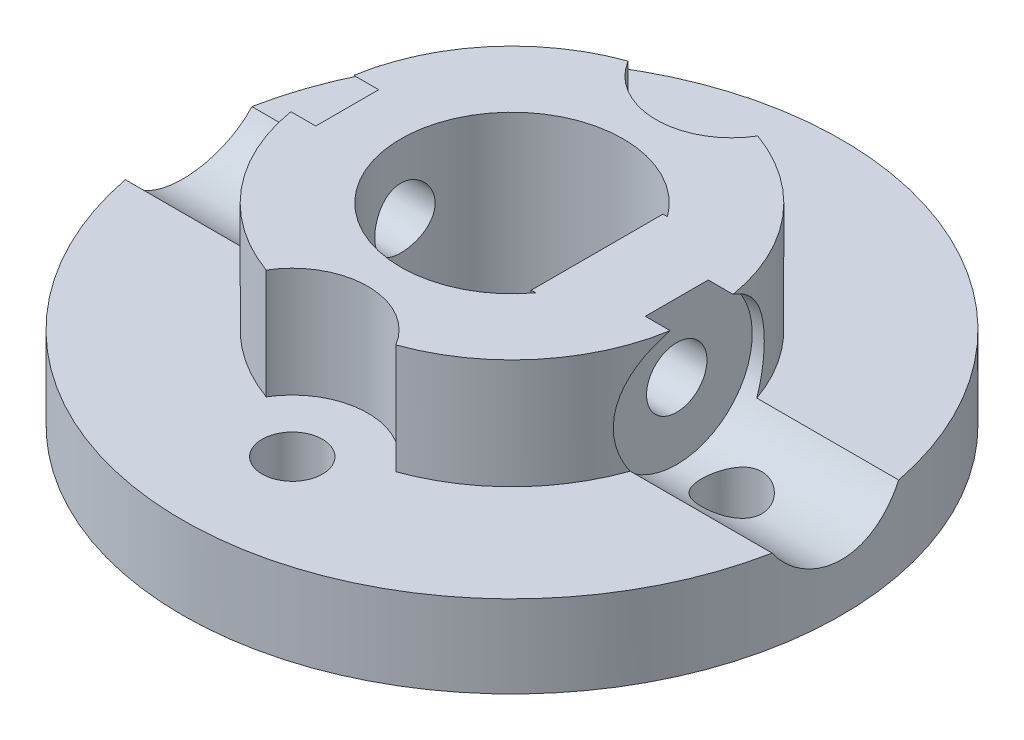
from build123d import *

# Parameters (mm, degrees)
STOCK_HORN_DRIVE_FLANGE_START              = 41
STOCK_HORN_DRIVE_FLANGE_PROFILE_R          = 12
STOCK_HORN_DRIVE_FLANGE_PROFILE_R_2        = 4.05
STOCK_HORN_DRIVE_FLANGE_DEPTH              = 3
D_COUPLING_RING_START                      = 44
D_COUPLING_RING_PROFILE_R                  = 7
D_COUPLING_RING_PROFILE_R_2                = 4.05
D_COUPLING_RING_DEPTH                      = 4
D_KEY_LAND_START                           = 44
D_KEY_LAND_PROFILE_W                       = 2.9
D_KEY_LAND_PROFILE_H                       = 4.8
D_KEY_LAND_DEPTH                           = 4
STOCK_HORN_SCREWS_START                    = 39
STOCK_HORN_SCREWS_PROFILE_R                = 1.1
STOCK_HORN_SCREWS_DEPTH                    = 12.911688245
TWO_HORN_WASHER_CLEARANCES_START           = 44
TWO_HORN_WASHER_CLEARANCES_PROFILE_R       = 2.75
TWO_HORN_WASHER_CLEARANCES_DEPTH           = 4
YAW_POSITIVE_RETENTION_CROSSBOLT_START     = -10
YAW_POSITIVE_RETENTION_CROSSBOLT_PROFILE_R = 1.1
YAW_POSITIVE_RETENTION_CROSSBOLT_DEPTH     = 61.911688245
CROSSBOLT_FLAT_SEAT_CUT_12_START           = -12
CROSSBOLT_FLAT_SEAT_12_R                   = 2.75
CROSSBOLT_FLAT_SEAT_CUT_12_DEPTH           = 6
CROSSBOLT_FLAT_SEAT_CUT_6_START            = 6
CROSSBOLT_FLAT_SEAT_6_R                    = 2.75
CROSSBOLT_FLAT_SEAT_CUT_6_DEPTH            = 6


with BuildPart() as part:
    # Stock_horn_drive_flange_profile → Stock_horn_drive_flange (new body)
    with BuildSketch(Plane(origin=(0, 0, 0), x_dir=(1, 0, 0), z_dir=(0, 1, 0)).offset(STOCK_HORN_DRIVE_FLANGE_START)):
        with Locations(Location((0, 0, 0), (0, 0, 270))):
            Circle(STOCK_HORN_DRIVE_FLANGE_PROFILE_R)
        with Locations(Location((0, 0, 0), (0, 0, 270))):
            Circle(STOCK_HORN_DRIVE_FLANGE_PROFILE_R_2, mode=Mode.SUBTRACT)
    extrude(amount=STOCK_HORN_DRIVE_FLANGE_DEPTH)

    # D_coupling_ring_profile → D_coupling_ring (add)
    with BuildSketch(Plane(origin=(0, 0, 0), x_dir=(1, 0, 0), z_dir=(0, 1, 0)).offset(D_COUPLING_RING_START)):
        with Locations(Location((0, 0, 0), (0, 0, 270))):
            Circle(D_COUPLING_RING_PROFILE_R)
        with Locations(Location((0, 0, 0), (0, 0, 270))):
            Circle(D_COUPLING_RING_PROFILE_R_2, mode=Mode.SUBTRACT)
    extrude(amount=D_COUPLING_RING_DEPTH)

    # D_key_land_profile → D_key_land (add)
    with BuildSketch(Plane(origin=(0, 0, 0), x_dir=(1, 0, 0), z_dir=(0, 1, 0)).offset(D_KEY_LAND_START)):
        with Locations((4.55, 0)):
            Rectangle(D_KEY_LAND_PROFILE_W, D_KEY_LAND_PROFILE_H)
    extrude(amount=D_KEY_LAND_DEPTH)

    # Stock_horn_screws_profile → Stock_horn_screws (cut, through all)
    with BuildSketch(Plane(origin=(0, 0, 0), x_dir=(1, 0, 0), z_dir=(0, 1, 0)).offset(STOCK_HORN_SCREWS_START)):
        with Locations(Location((-8, 0, 0), (0, 0, 22.9239414))):
            Circle(STOCK_HORN_SCREWS_PROFILE_R)
        with Locations(Location((8, 0, 0), (0, 0, 157.0760586))):
            Circle(STOCK_HORN_SCREWS_PROFILE_R)
        with Locations(Location((0, -8, 0), (0, 0, 67.0760586))):
            Circle(STOCK_HORN_SCREWS_PROFILE_R)
        with Locations(Location((0, 8, 0), (0, 0, 292.9239414))):
            Circle(STOCK_HORN_SCREWS_PROFILE_R)
    extrude(amount=STOCK_HORN_SCREWS_DEPTH, mode=Mode.SUBTRACT)

    # Two_horn_washer_clearances_profile → Two_horn_washer_clearances (cut)
    with BuildSketch(Plane(origin=(0, 0, 0), x_dir=(1, 0, 0), z_dir=(0, 1, 0)).offset(TWO_HORN_WASHER_CLEARANCES_START)):
        with Locations((0, -8)):
            Circle(TWO_HORN_WASHER_CLEARANCES_PROFILE_R)
        with Locations((0, 8)):
            Circle(TWO_HORN_WASHER_CLEARANCES_PROFILE_R)
    extrude(amount=TWO_HORN_WASHER_CLEARANCES_DEPTH, mode=Mode.SUBTRACT)

    # Yaw_positive_retention_crossbolt_profile → Yaw_positive_retention_crossbolt (cut, through all)
    with BuildSketch(Plane(origin=(0, 0, 0), x_dir=(0, 0, -1), z_dir=(1, 0, 0)).offset(YAW_POSITIVE_RETENTION_CROSSBOLT_START)):
        with Locations(Location((0, 45.5, 0), (0, 0, 180))):
            Circle(YAW_POSITIVE_RETENTION_CROSSBOLT_PROFILE_R)
    extrude(amount=YAW_POSITIVE_RETENTION_CROSSBOLT_DEPTH, mode=Mode.SUBTRACT)

    # Crossbolt_flat_seat_-12 → Crossbolt_flat_seat_cut_-12 (cut)
    with BuildSketch(Plane(origin=(0, 0, 0), x_dir=(0, 0, -1), z_dir=(1, 0, 0)).offset(CROSSBOLT_FLAT_SEAT_CUT_12_START)):
        with Locations((0, 45.5)):
            Circle(CROSSBOLT_FLAT_SEAT_12_R)
    extrude(amount=CROSSBOLT_FLAT_SEAT_CUT_12_DEPTH, mode=Mode.SUBTRACT)

    # Crossbolt_flat_seat_6 → Crossbolt_flat_seat_cut_6 (cut)
    with BuildSketch(Plane(origin=(0, 0, 0), x_dir=(0, 0, -1), z_dir=(1, 0, 0)).offset(CROSSBOLT_FLAT_SEAT_CUT_6_START)):
        with Locations((0, 45.5)):
            Circle(CROSSBOLT_FLAT_SEAT_6_R)
    extrude(amount=CROSSBOLT_FLAT_SEAT_CUT_6_DEPTH, mode=Mode.SUBTRACT)


solid = part.part
